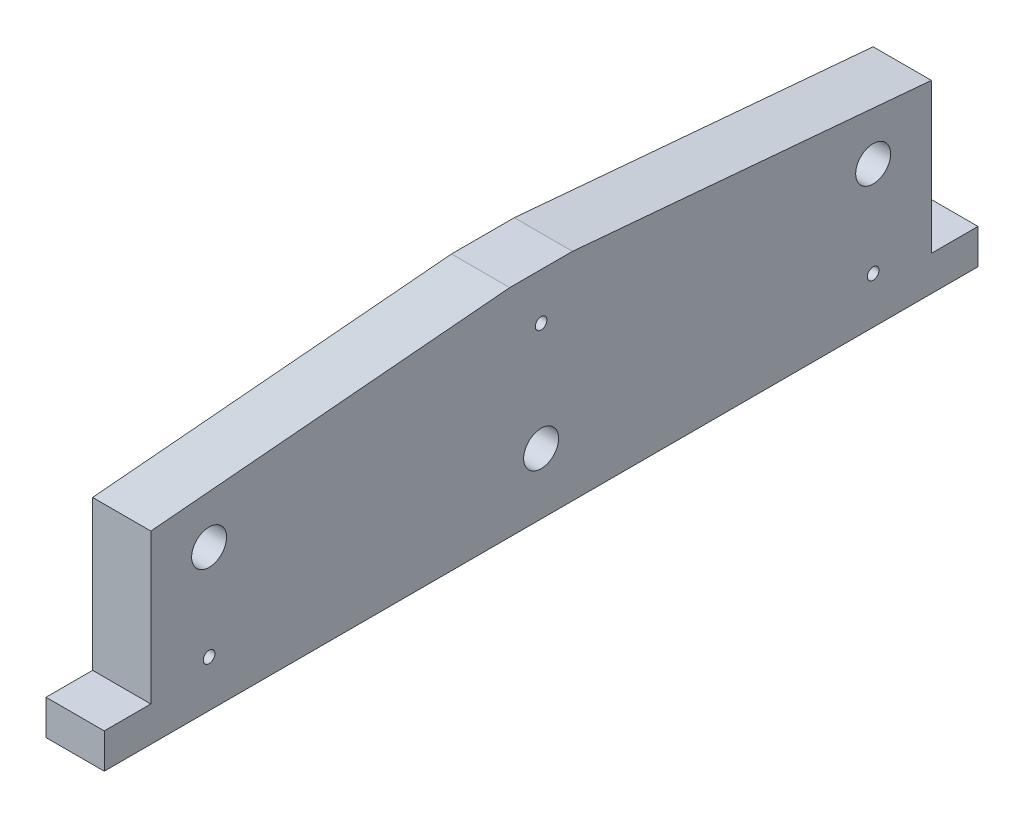
from build123d import *

# Parameters (mm, degrees)
RESSALTO_EXTRUS_O2_DEPTH = 10
SKETCH1_R                = 1
SKETCH1_R_2              = 3
CUT_EXTRUDE1_DEPTH       = 85.442226256


with BuildPart() as part:
    # Esboço2 → Ressalto-extrusão2 (new body)
    with BuildSketch(Plane(origin=(0, 0, 0), x_dir=(0, 0, -1), z_dir=(1, 0, 0))):
        Polygon((67, -31.48985963), (75, -31.48985963), (75, -37.48985963), (-75, -37.48985963), (-75, -31.48985963), (-67, -31.48985963), (-67, -5.780687565), (-5.390847643, -0.390585164), (0, -0.390585164), (5.390847643, -0.390585164), (67, -5.780687565), align=None)
    extrude(amount=RESSALTO_EXTRUS_O2_DEPTH)

    # Sketch1 → Cut-Extrude1 (cut, through all)
    with BuildSketch(Plane.ZY):
        with Locations((-57, -29.48985963)):
            Circle(SKETCH1_R)
        with Locations(Location((57, -29.48985963, 0), (0, 0, 180))):
            Circle(SKETCH1_R)
        with Locations((0, -8.390585164)):
            Circle(SKETCH1_R)
        with Locations((0, -27.002843351)):
            Circle(SKETCH1_R_2)
        with Locations((-57, -13.178770397)):
            Circle(SKETCH1_R_2)
        with Locations((57, -13.178770397)):
            Circle(SKETCH1_R_2)
    extrude(amount=-CUT_EXTRUDE1_DEPTH, mode=Mode.SUBTRACT)


solid = part.part
